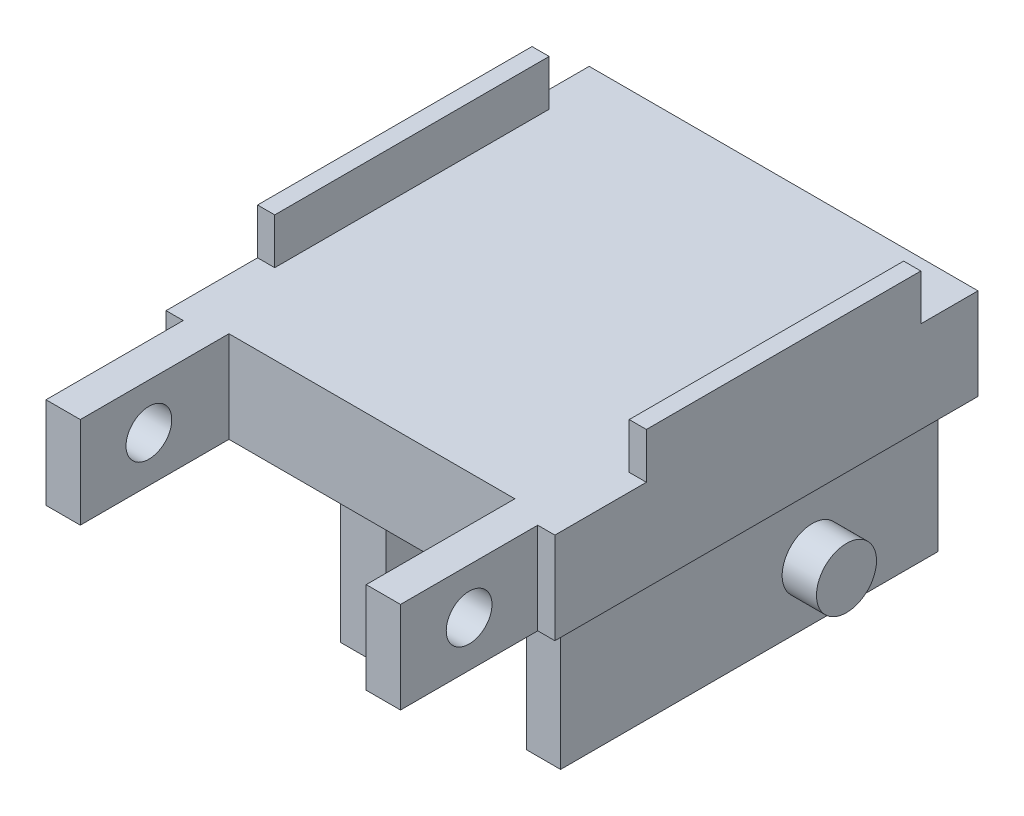
from build123d import *

# Parameters (mm, degrees)
SKETCH_1_W          = 34
SKETCH_1_H          = 49
EXTRUDE_1_DEPTH     = 8
SKETCH_2_W          = 1.5
SKETCH_2_H          = 24
EXTRUDE_2_DEPTH     = 4
SKETCH_3_W          = 1.5
SKETCH_3_H          = 12
SKETCH_3_W_2        = 25
SKETCH_3_H_2        = 13
CUT_EXTRUDE_1_DEPTH = 8
CUT_EXTRUDE_2_REACH = 44.432
SKETCH_4_R          = 2
EXTRUDE_3_DEPTH     = 8
CUT_EXTRUDE_4_DEPTH = 8
SKETCH_6_W          = 4
SKETCH_6_H          = 4
SKETCH_6_W_2        = 3
SKETCH_6_H_2        = 33
EXTRUDE_5_DEPTH     = 12
SKETCH_7_R          = 2.625
EXTRUDE_6_DEPTH     = 3
SKETCH_8_R          = 0.55
CUT_EXTRUDE_5_DEPTH = 4


with BuildPart() as part:
    # 草图1 → 凸台-拉伸1 (new body)
    with BuildSketch(Plane(origin=(0, 0, 0), x_dir=(1, 0, 0), z_dir=(0, 1, 0))):
        Rectangle(SKETCH_1_W, SKETCH_1_H)
    extrude(amount=EXTRUDE_1_DEPTH)

    # 草图2 → 凸台-拉伸2 (add)
    with BuildSketch(Plane(origin=(0, 8, 0), x_dir=(1, 0, 0), z_dir=(0, 1, 0))):
        with Locations((-16.25, 7.5)):
            Rectangle(SKETCH_2_W, SKETCH_2_H)
        with Locations((16.25, 7.5)):
            Rectangle(SKETCH_2_W, SKETCH_2_H)
    extrude(amount=EXTRUDE_2_DEPTH)

    # 草图3 → 切除-拉伸1 (cut)
    with BuildSketch(Plane(origin=(0, 8, 0), x_dir=(1, 0, 0), z_dir=(0, 1, 0))):
        with Locations((-16.25, -18.5)):
            Rectangle(SKETCH_3_W, SKETCH_3_H)
        with Locations((16.25, -18.5)):
            Rectangle(SKETCH_3_W, SKETCH_3_H)
        with Locations((0, -18)):
            Rectangle(SKETCH_3_W_2, SKETCH_3_H_2)
    extrude(amount=-CUT_EXTRUDE_1_DEPTH, mode=Mode.SUBTRACT)

    # 切除-拉伸2: up to this face of the body (flat: up to its plane)
    cut_extrude_2_end = Plane(part.part.faces().sort_by_distance((15.5, 4, 18.5))[0])
    # 草图4 → 切除-拉伸2 (cut, up to the picked face)
    with BuildSketch(Plane.ZY.offset(15.5), mode=Mode.PRIVATE) as cut_extrude_2_sk1:
        with Locations((18.5, 4)):
            Circle(SKETCH_4_R)
    cut_extrude_2_tool1 = split(extrude(cut_extrude_2_sk1.sketch, amount=-CUT_EXTRUDE_2_REACH, mode=Mode.PRIVATE), bisect_by=cut_extrude_2_end, keep=Keep.BOTH, mode=Mode.PRIVATE)
    add(cut_extrude_2_tool1.solids().sort_by(Axis((-15.5, 4, 18.5), (1, 0, 0)))[0], mode=Mode.SUBTRACT)

    # 草图5 → 凸台-拉伸3 (add)
    with BuildSketch(Plane.XZ):
        Polygon((4, 11.5), (-4, 11.5), (-4, 41.5), (-13, 41.5), (-13, 56.5), (13, 56.5), (13, 41.5), (4, 41.5), align=None)
    extrude(amount=-EXTRUDE_3_DEPTH)

    # 草图5<2> → 切除-拉伸4 (cut)
    with BuildSketch(Plane.XZ):
        Polygon((4, 11.5), (-4, 11.5), (-4, 41.5), (-13, 41.5), (-13, 56.5), (13, 56.5), (13, 41.5), (4, 41.5), align=None)
    extrude(amount=-CUT_EXTRUDE_4_DEPTH, mode=Mode.SUBTRACT)

    # 草图6 → 凸台-拉伸5 (add)
    with BuildSketch(Plane.XZ):
        with Locations((-2.25, 8)):
            Rectangle(SKETCH_6_W, SKETCH_6_H)
        with Locations((13.5, -6.5)):
            Rectangle(SKETCH_6_W_2, SKETCH_6_H_2)
        Polygon((-4.25, -19), (-4.25, -19.5), (-4.25, -23), (0, -23), (0, -19.5), (0, -19), align=None)
    extrude(amount=EXTRUDE_5_DEPTH)

    # 草图7 → 凸台-拉伸6 (add)
    with BuildSketch(Plane(origin=(15, 0, 0), x_dir=(0, 0, -1), z_dir=(1, 0, 0))):
        with Locations((12, -7)):
            Circle(SKETCH_7_R)
    extrude(amount=EXTRUDE_6_DEPTH)

    # 草图8 → 切除-拉伸5 (cut)
    with BuildSketch(Plane.ZY.offset(4.25)):
        with Locations((8, -7)):
            Circle(SKETCH_8_R)
        with Locations((-21, -7)):
            Circle(SKETCH_8_R)
    extrude(amount=-CUT_EXTRUDE_5_DEPTH, mode=Mode.SUBTRACT)


solid = part.part
